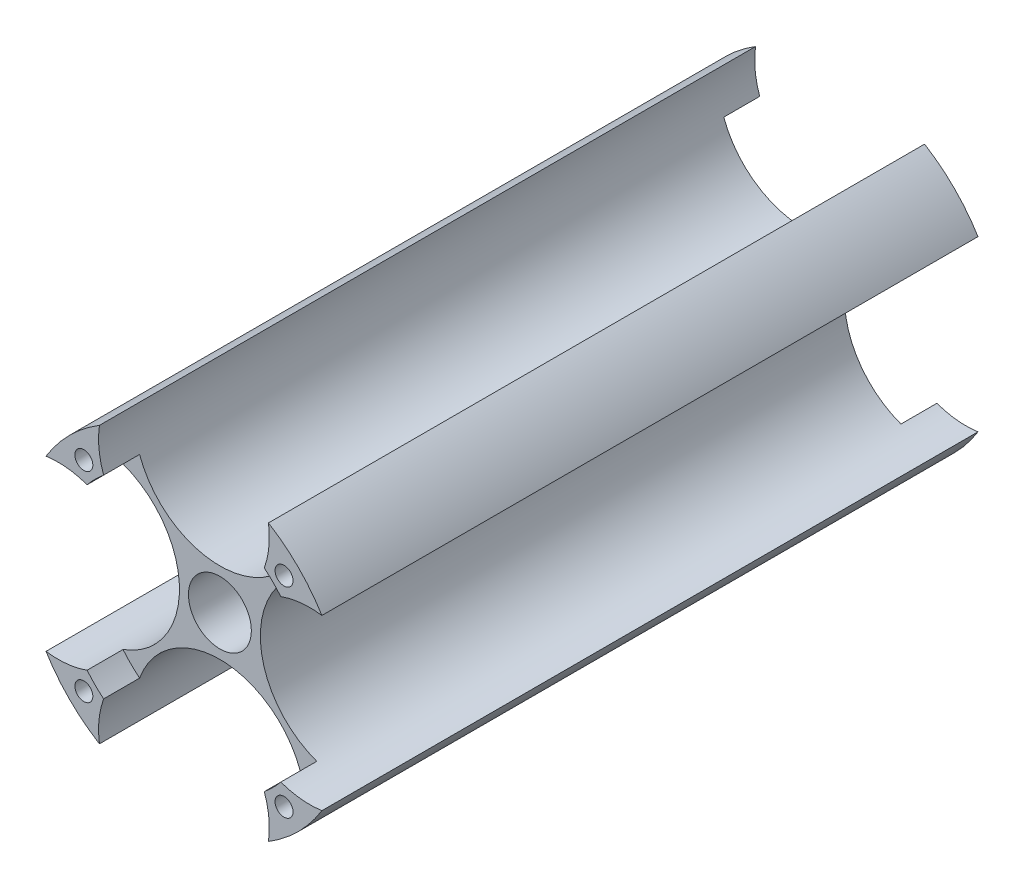
from build123d import *
from build123d.topology import SkipClean

# Parameters (mm, degrees)
SKETCH_1_R      = 1
SKETCH_1_R_2    = 3.5
EXTRUDE_1_DEPTH = 65
SKETCH_2_R      = 1
EXTRUDE_2_DEPTH = 4
EXTRUDE_START   = 4
SKETCH_3_R      = 1
EXTRUDE_3_DEPTH = 4


with BuildPart() as part:
    # Эскиз1 → Бобышка-Вытянуть1 (new body)
    with BuildSketch(Plane.XY):
        with BuildLine():
            ThreePointArc((15.348214286, -9.403845928), (4.5, 0), (15.348214286, 9.403845928))
            ThreePointArc((15.348214286, 9.403845928), (12.727922061, 12.727922061), (9.403845928, 15.348214286))
            ThreePointArc((9.403845928, 15.348214286), (9.475930992, 14.675819385), (9.5, 14))
            ThreePointArc((9.5, 14), (-0.675819385, 4.524069008), (-9.403845928, 15.348214286))
            ThreePointArc((-9.403845928, 15.348214286), (-12.727922061, 12.727922061), (-15.348214286, 9.403845928))
            ThreePointArc((-15.348214286, 9.403845928), (-7.777381408, 7.178371532), (-4.5, 0))
            ThreePointArc((-4.5, 0), (-7.777381408, -7.178371532), (-15.348214286, -9.403845928))
            ThreePointArc((-15.348214286, -9.403845928), (-12.727922061, -12.727922061), (-9.403845928, -15.348214286))
            ThreePointArc((-9.403845928, -15.348214286), (-0.675819385, -4.524069008), (9.5, -14))
            ThreePointArc((9.5, -14), (9.475930992, -14.675819385), (9.403845928, -15.348214286))
            ThreePointArc((9.403845928, -15.348214286), (12.727922061, -12.727922061), (15.348214286, -9.403845928))
        make_face()
        with Locations((-11.136931804, -11.136931804)):
            Circle(SKETCH_1_R, mode=Mode.SUBTRACT)
        with Locations((11.136931804, -11.136931804)):
            Circle(SKETCH_1_R, mode=Mode.SUBTRACT)
        Circle(SKETCH_1_R_2, mode=Mode.SUBTRACT)
        with Locations((-11.136931804, 11.136931804)):
            Circle(SKETCH_1_R, mode=Mode.SUBTRACT)
        with Locations((11.136931804, 11.136931804)):
            Circle(SKETCH_1_R, mode=Mode.SUBTRACT)
    extrude(amount=EXTRUDE_1_DEPTH)

    # Эскиз2 → Бобышка-Вытянуть2 (add)
    # profile 1 of 4: a face of its own
    with BuildSketch(Plane.XY.offset(65)):
        with BuildLine():
            ThreePointArc((-9.403845928, -15.348214286), (-9.450740121, -13.033816183), (-8.936492023, -10.776785714))
            ThreePointArc((-8.936492023, -10.776785714), (-9.899494937, -9.899494937), (-10.776785714, -8.936492023))
            ThreePointArc((-10.776785714, -8.936492023), (-13.033816183, -9.450740121), (-15.348214286, -9.403845928))
            ThreePointArc((-15.348214286, -9.403845928), (-12.727922061, -12.727922061), (-9.403845928, -15.348214286))
        make_face()
        with Locations((-11.136931804, -11.136931804)):
            Circle(SKETCH_2_R, mode=Mode.SUBTRACT)
    # profile 2 of 4: a face of its own
    with BuildSketch(Plane.XY.offset(65)):
        with BuildLine():
            ThreePointArc((15.348214286, -9.403845928), (13.033816183, -9.450740121), (10.776785714, -8.936492023))
            ThreePointArc((10.776785714, -8.936492023), (9.899494937, -9.899494937), (8.936492023, -10.776785714))
            ThreePointArc((8.936492023, -10.776785714), (9.358062679, -12.363948994), (9.5, -14))
            ThreePointArc((9.5, -14), (9.475930992, -14.675819385), (9.403845928, -15.348214286))
            ThreePointArc((9.403845928, -15.348214286), (12.727922061, -12.727922061), (15.348214286, -9.403845928))
        make_face()
        with Locations((11.136931804, -11.136931804)):
            Circle(SKETCH_2_R, mode=Mode.SUBTRACT)
    # profile 3 of 4: a face of its own
    with BuildSketch(Plane.XY.offset(65)):
        with BuildLine():
            ThreePointArc((8.936492023, 10.776785714), (9.899494937, 9.899494937), (10.776785714, 8.936492023))
            ThreePointArc((10.776785714, 8.936492023), (13.033816183, 9.450740121), (15.348214286, 9.403845928))
            ThreePointArc((15.348214286, 9.403845928), (12.727922061, 12.727922061), (9.403845928, 15.348214286))
            ThreePointArc((9.403845928, 15.348214286), (9.475930992, 14.675819385), (9.5, 14))
            ThreePointArc((9.5, 14), (9.358062679, 12.363948994), (8.936492023, 10.776785714))
        make_face()
        with Locations((11.136931804, 11.136931804)):
            Circle(SKETCH_2_R, mode=Mode.SUBTRACT)
    # profile 4 of 4: a face of its own
    with BuildSketch(Plane.XY.offset(65)):
        with BuildLine():
            ThreePointArc((-10.776785714, 8.936492023), (-9.899494937, 9.899494937), (-8.936492023, 10.776785714))
            ThreePointArc((-8.936492023, 10.776785714), (-9.450740121, 13.033816183), (-9.403845928, 15.348214286))
            ThreePointArc((-9.403845928, 15.348214286), (-12.727922061, 12.727922061), (-15.348214286, 9.403845928))
            ThreePointArc((-15.348214286, 9.403845928), (-13.033816183, 9.450740121), (-10.776785714, 8.936492023))
        make_face()
        with Locations((-11.136931804, 11.136931804)):
            Circle(SKETCH_2_R, mode=Mode.SUBTRACT)
    extrude(amount=EXTRUDE_2_DEPTH)

    # Эскиз3 → Бобышка-Вытянуть3 (add)
    # profile 1 of 4: a face of its own
    with SkipClean():  # the faces are left unmerged after this step: merging them gives an invalid solid
        with BuildSketch(Plane(origin=(0, 0, 0), x_dir=(-1, 0, 0), z_dir=(0, 0, -1)).offset(EXTRUDE_START)):
            with BuildLine():
                ThreePointArc((-9.403845928, 15.348214286), (-12.727922061, 12.727922061), (-15.348214286, 9.403845928))
                ThreePointArc((-15.348214286, 9.403845928), (-13.033816183, 9.450740121), (-10.776785714, 8.936492023))
                ThreePointArc((-10.776785714, 8.936492023), (-9.899494937, 9.899494937), (-8.936492023, 10.776785714))
                ThreePointArc((-8.936492023, 10.776785714), (-9.450740121, 13.033816183), (-9.403845928, 15.348214286))
            make_face()
            with Locations((-11.136931804, 11.136931804)):
                Circle(SKETCH_3_R, mode=Mode.SUBTRACT)
        # profile 2 of 4: a face of its own
        with BuildSketch(Plane(origin=(0, 0, 0), x_dir=(-1, 0, 0), z_dir=(0, 0, -1)).offset(EXTRUDE_START)):
            with BuildLine():
                ThreePointArc((-15.348214286, -9.403845928), (-12.727922061, -12.727922061), (-9.403845928, -15.348214286))
                ThreePointArc((-9.403845928, -15.348214286), (-9.450740121, -13.033816183), (-8.936492023, -10.776785714))
                ThreePointArc((-8.936492023, -10.776785714), (-9.899494937, -9.899494937), (-10.776785714, -8.936492023))
                ThreePointArc((-10.776785714, -8.936492023), (-13.033816183, -9.450740121), (-15.348214286, -9.403845928))
            make_face()
            with Locations((-11.136931804, -11.136931804)):
                Circle(SKETCH_3_R, mode=Mode.SUBTRACT)
        # profile 3 of 4: a face of its own
        with BuildSketch(Plane(origin=(0, 0, 0), x_dir=(-1, 0, 0), z_dir=(0, 0, -1)).offset(EXTRUDE_START)):
            with BuildLine():
                ThreePointArc((9.5, -14), (9.475930992, -14.675819385), (9.403845928, -15.348214286))
                ThreePointArc((9.403845928, -15.348214286), (12.727922061, -12.727922061), (15.348214286, -9.403845928))
                ThreePointArc((15.348214286, -9.403845928), (13.033816183, -9.450740121), (10.776785714, -8.936492023))
                ThreePointArc((10.776785714, -8.936492023), (9.899494937, -9.899494937), (8.936492023, -10.776785714))
                ThreePointArc((8.936492023, -10.776785714), (9.358062679, -12.363948994), (9.5, -14))
            make_face()
            with Locations((11.136931804, -11.136931804)):
                Circle(SKETCH_3_R, mode=Mode.SUBTRACT)
        # profile 4 of 4: a face of its own
        with BuildSketch(Plane(origin=(0, 0, 0), x_dir=(-1, 0, 0), z_dir=(0, 0, -1)).offset(EXTRUDE_START)):
            with BuildLine():
                ThreePointArc((10.776785714, 8.936492023), (13.033816183, 9.450740121), (15.348214286, 9.403845928))
                ThreePointArc((15.348214286, 9.403845928), (12.727922061, 12.727922061), (9.403845928, 15.348214286))
                ThreePointArc((9.403845928, 15.348214286), (9.475930992, 14.675819385), (9.5, 14))
                ThreePointArc((9.5, 14), (9.358062679, 12.363948994), (8.936492023, 10.776785714))
                ThreePointArc((8.936492023, 10.776785714), (9.899494937, 9.899494937), (10.776785714, 8.936492023))
            make_face()
            with Locations((11.136931804, 11.136931804)):
                Circle(SKETCH_3_R, mode=Mode.SUBTRACT)
        extrude(amount=-EXTRUDE_3_DEPTH)


solid = part.part
